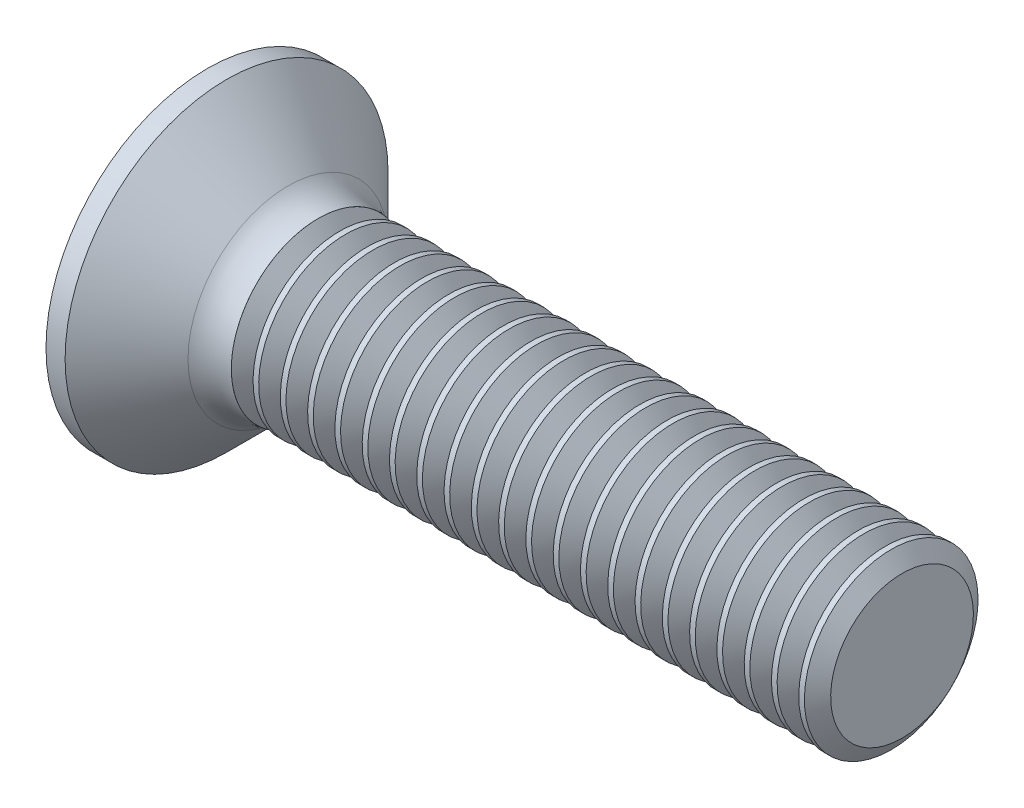
from build123d import *

# Parameters (mm, degrees)
FILLET1_R       = 1.3
RECPAT_COUNT    = 2
RECPAT_ANGLE    = 90
THDSCHPAT_COUNT = 22
THDSCHPAT_PITCH = 0.785714286


with BuildPart() as part:
    # BodySke → Base-Revolve (revolve)
    with BuildSketch(Plane.XY, mode=Mode.PRIVATE) as base_revolve_sk:
        Polygon((0, 0), (0, 4.65), (0.55, 4.65), (2.7, 2.5), (20, 2.5), (20, 0), align=None)
    revolve(base_revolve_sk.sketch.rotate(Axis((-6.35, 0, 0), (1, 0, 0)), 90), axis=Axis((-6.35, 0, 0), (1, 0, 0)))

    # Fillet1
    fillet1_edges = [part.edges().sort_by_distance(p)[0] for p in [
        (2.7, 0, -2.5),
    ]]
    fillet(fillet1_edges, radius=FILLET1_R)

    # Sketch3 → Recess section 0
    with BuildSketch(Plane.ZY):
        with BuildLine():
            Line((-0.515, 2.45), (0.515, 2.45))
            Line((0.515, 2.45), (0.515, -2.45))
            Line((0.515, -2.45), (-0.515, -2.45))
            Line((-0.515, -2.45), (-0.515, 2.45))
        make_face()
    # Sketch4 → Recess section 1
    with BuildSketch(Plane.ZY.offset(-3.05)):
        with BuildLine():
            Line((-0.515, 0.92932635), (0.515, 0.92932635))
            Line((0.515, 0.92932635), (0.515, -0.92932635))
            Line((0.515, -0.92932635), (-0.515, -0.92932635))
            Line((-0.515, -0.92932635), (-0.515, 0.92932635))
        make_face()
    recess = loft(mode=Mode.SUBTRACT)

    # RecPat: Recess ×2 about axis
    recpat_axis = Axis((0, 0, 0), (1, 0, 0))
    for i in range(1, RECPAT_COUNT):
        add(recess.rotate(recpat_axis, i * RECPAT_ANGLE / (RECPAT_COUNT - 1)), mode=Mode.SUBTRACT)

    # RecCorSke → RecessCore (revolve, cut)
    with BuildSketch(Plane.XY, mode=Mode.PRIVATE) as recesscore_sk:
        Polygon((0, 0), (0, 1.064276776), (3.05, 0.851), (3.326506661, 0), align=None)
    revolve(recesscore_sk.sketch.rotate(Axis((-3.175, 0, 0), (1, 0, 0)), 90), axis=Axis((-3.175, 0, 0), (1, 0, 0)), mode=Mode.SUBTRACT)

    # ThdSchSke → ThreadSchematic (revolve, cut)
    with BuildSketch(Plane.XY):
        Polygon((3.500001, -2.055), (3.188408645, -2.5), (3.188408645, -3.125), (3.811593355, -3.125), (3.811593355, -2.5), align=None)
    threadschematic = revolve(axis=Axis((-3.175, 0, 0), (1, 0, 0)), mode=Mode.SUBTRACT)

    # ThdSchPat: ThreadSchematic ×22
    with Locations(*[(i * THDSCHPAT_PITCH, 0, 0) for i in range(1, THDSCHPAT_COUNT)]):
        add(threadschematic, mode=Mode.SUBTRACT)


solid = part.part
